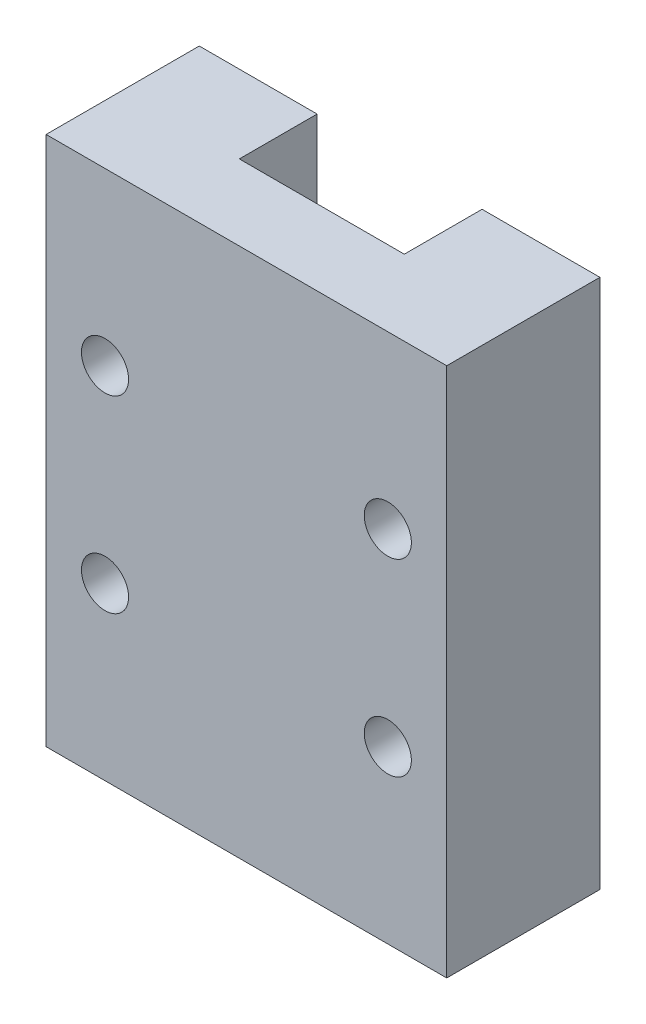
from build123d import *

# Parameters (mm, degrees)
SKETCH1_W           = 17
SKETCH1_H           = 22.5
BOSS_EXTRUDE1_DEPTH = 6.5
SKETCH2_R           = 1
CUT_EXTRUDE1_DEPTH  = 2.5
SKETCH3_W           = 7
SKETCH3_H           = 6.6
CUT_EXTRUDE2_DEPTH  = 25.914855007


with BuildPart() as part:
    # Sketch1 → Boss-Extrude1 (new body)
    with BuildSketch(Plane.XY):
        Rectangle(SKETCH1_W, SKETCH1_H)
    extrude(amount=-BOSS_EXTRUDE1_DEPTH)

    # Sketch2 → Cut-Extrude1 (cut)
    with BuildSketch(Plane.XY):
        with Locations((6, 4)):
            Circle(SKETCH2_R)
        with Locations((6, -4)):
            Circle(SKETCH2_R)
        with Locations((-6, -4)):
            Circle(SKETCH2_R)
        with Locations((-6, 4)):
            Circle(SKETCH2_R)
    extrude(amount=-CUT_EXTRUDE1_DEPTH, mode=Mode.SUBTRACT)

    # Sketch3 → Cut-Extrude2 (cut, through all)
    with BuildSketch(Plane.XZ.offset(11.25)):
        with Locations((0, -6.5)):
            Rectangle(SKETCH3_W, SKETCH3_H)
    extrude(amount=-CUT_EXTRUDE2_DEPTH, mode=Mode.SUBTRACT)


solid = part.part
